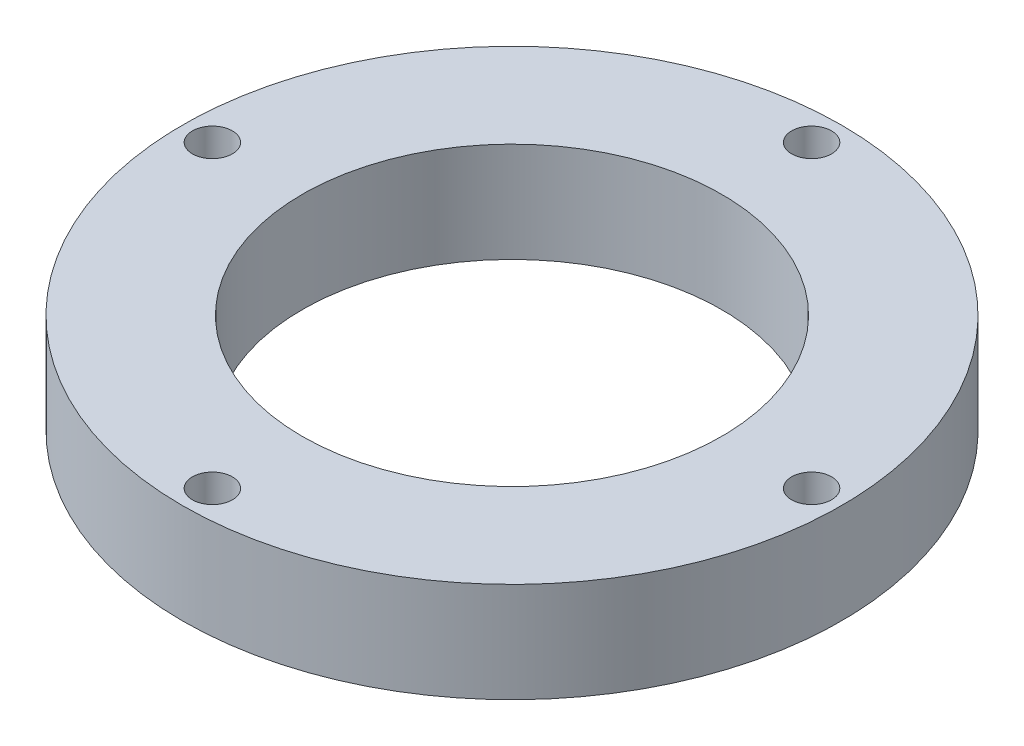
from build123d import *

# Parameters (mm, degrees)
SKETCH1_R           = 41.91
BOSS_EXTRUDE1_DEPTH = 12.7
SKETCH2_R           = 13.97
CUT_EXTRUDE1_DEPTH  = 12.7
SKETCH2_3_R         = 26.67
SKETCH2_3_R_2       = 13.97
CUT_EXTRUDE2_DEPTH  = 12.7
SCALE1_SCALE        = 2
SCALE2_SCALE        = 0.5
SKETCH3_R           = 2.54
CUT_EXTRUDE3_DEPTH  = 12.7
CIRPATTERN1_COUNT   = 4


with BuildPart() as part:
    # Sketch1 → Boss-Extrude1 (new body)
    with BuildSketch(Plane(origin=(0, 0, 0), x_dir=(1, 0, 0), z_dir=(0, 1, 0))):
        with Locations(Location((0, 0, 0), (0, 0, 270))):
            Circle(SKETCH1_R)
    extrude(amount=BOSS_EXTRUDE1_DEPTH)

    # Sketch2 → Cut-Extrude1 (cut)
    with BuildSketch(Plane(origin=(0, 12.7, 0), x_dir=(1, 0, 0), z_dir=(0, 1, 0))):
        with Locations(Location((0, 0, 0), (0, 0, 270))):
            Circle(SKETCH2_R)
    extrude(amount=-CUT_EXTRUDE1_DEPTH, mode=Mode.SUBTRACT)

    # Sketch2<3> → Cut-Extrude2 (cut)
    with BuildSketch(Plane(origin=(0, 12.7, 0), x_dir=(1, 0, 0), z_dir=(0, 1, 0))):
        with Locations(Location((0, 0, 0), (0, 0, 270))):
            Circle(SKETCH2_3_R)
        Circle(SKETCH2_3_R_2, mode=Mode.SUBTRACT)
    extrude(amount=-CUT_EXTRUDE2_DEPTH, mode=Mode.SUBTRACT)


with BuildPart() as part_1:
    # Scale1: scaled about (0, 6.35, 0)
    add(part.part.scale(SCALE1_SCALE).moved(Location((0, -6.35, 0))))


with BuildPart() as part_2:
    # Scale2: scaled about (0, 6.35, 0)
    add(part_1.part.scale(SCALE2_SCALE).moved(Location((0, 3.175, 0))))

    # Sketch3 → Cut-Extrude3 (cut)
    with BuildSketch(Plane(origin=(0, 12.7, 0), x_dir=(1, 0, 0), z_dir=(0, 1, 0))):
        with Locations(Location((0, 38.1, 0), (0, 0, 270))):
            Circle(SKETCH3_R)
    cut_extrude3 = extrude(amount=-CUT_EXTRUDE3_DEPTH, mode=Mode.SUBTRACT)

    # CirPattern1: Cut-Extrude3 ×4 about axis
    cirpattern1_axis = Axis((0, 0, 0), (0, 1, 0))
    for i in range(1, CIRPATTERN1_COUNT):
        add(cut_extrude3.rotate(cirpattern1_axis, i * 360 / CIRPATTERN1_COUNT), mode=Mode.SUBTRACT)


solid = part_2.part
